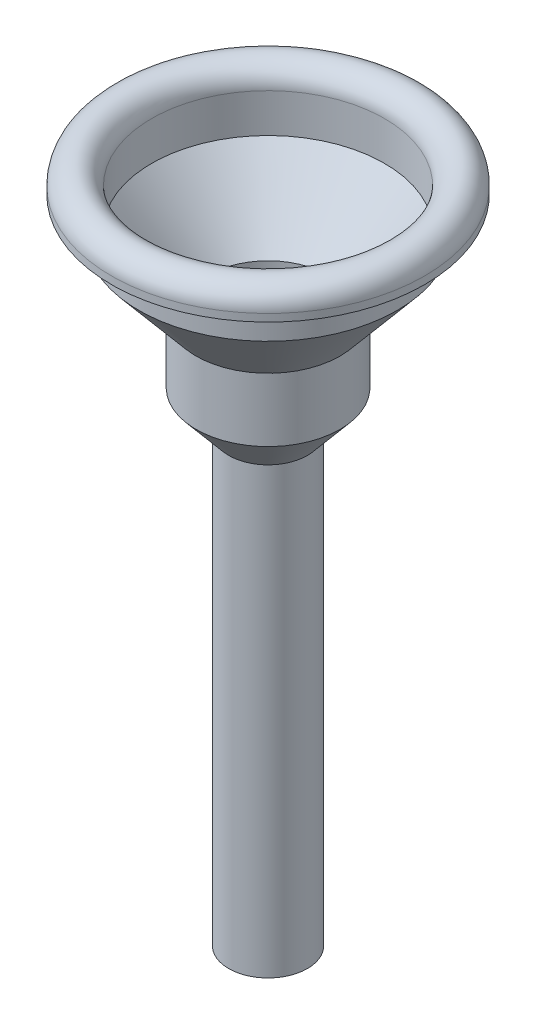
from build123d import *


with BuildPart() as part:
    # 草图1 → 旋转1 (revolve)
    with BuildSketch(Plane.XY):
        with BuildLine():
            ThreePointArc((0.917066371, 5.184978302), (1.074736956, 5.342648887), (1.232407542, 5.184978302))
            Line((1.232407542, 5.184978302), (1.232407542, 5.126017406))
            Line((1.232407542, 5.126017406), (1.132407542, 5.126017406))
            Line((1.132407542, 5.126017406), (1.132407542, 5.184978302))
            ThreePointArc((1.132407542, 5.184978302), (1.074736956, 5.242648887), (1.017066371, 5.184978302))
            Line((1.017066371, 5.184978302), (1.017066371, 4.842648887))
            Line((1.017066371, 4.842648887), (0.567115044, 4.306417777))
            Line((0.567115044, 4.306417777), (0.567115044, 3.806417777))
            Line((0.567115044, 3.806417777), (0.31, 3.5))
            Line((0.31, 3.5), (0.31, 0))
            Line((0.31, 0), (0.27, 0))
            Line((0.27, 0), (0.27, 3.607902239))
            Line((0.27, 3.607902239), (0.467115044, 3.842814801))
            Line((0.467115044, 3.842814801), (0.467115044, 4.342814801))
            Line((0.467115044, 4.342814801), (0.917066371, 4.879045911))
            Line((0.917066371, 4.879045911), (0.917066371, 5.184978302))
        make_face()
    revolve(axis=Axis((0, -31.348606249, 0), (0, 1, 0)))


solid = part.part
